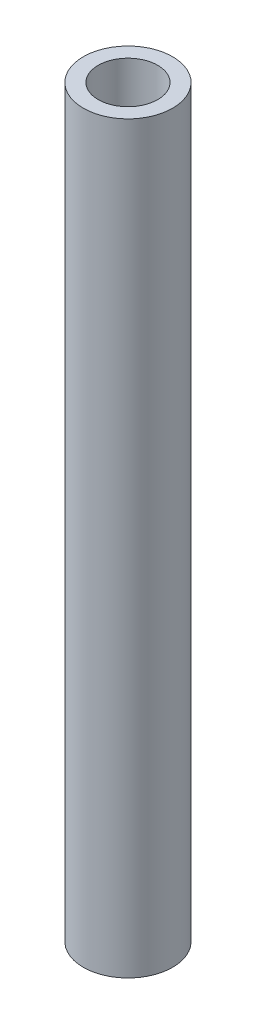
from build123d import *

# Parameters (mm, degrees)
SKETCH1_R           = 30
SKETCH1_R_2         = 20
BOSS_EXTRUDE1_DEPTH = 500


with BuildPart() as part:
    # Sketch1 → Boss-Extrude1 (new body)
    with BuildSketch(Plane(origin=(0, 0, 0), x_dir=(1, 0, 0), z_dir=(0, 1, 0))):
        with Locations(Location((0, 0, 0), (0, 0, 270))):
            Circle(SKETCH1_R)
        with Locations(Location((0, 0, 0), (0, 0, 270))):
            Circle(SKETCH1_R_2, mode=Mode.SUBTRACT)
    extrude(amount=BOSS_EXTRUDE1_DEPTH)


solid = part.part
